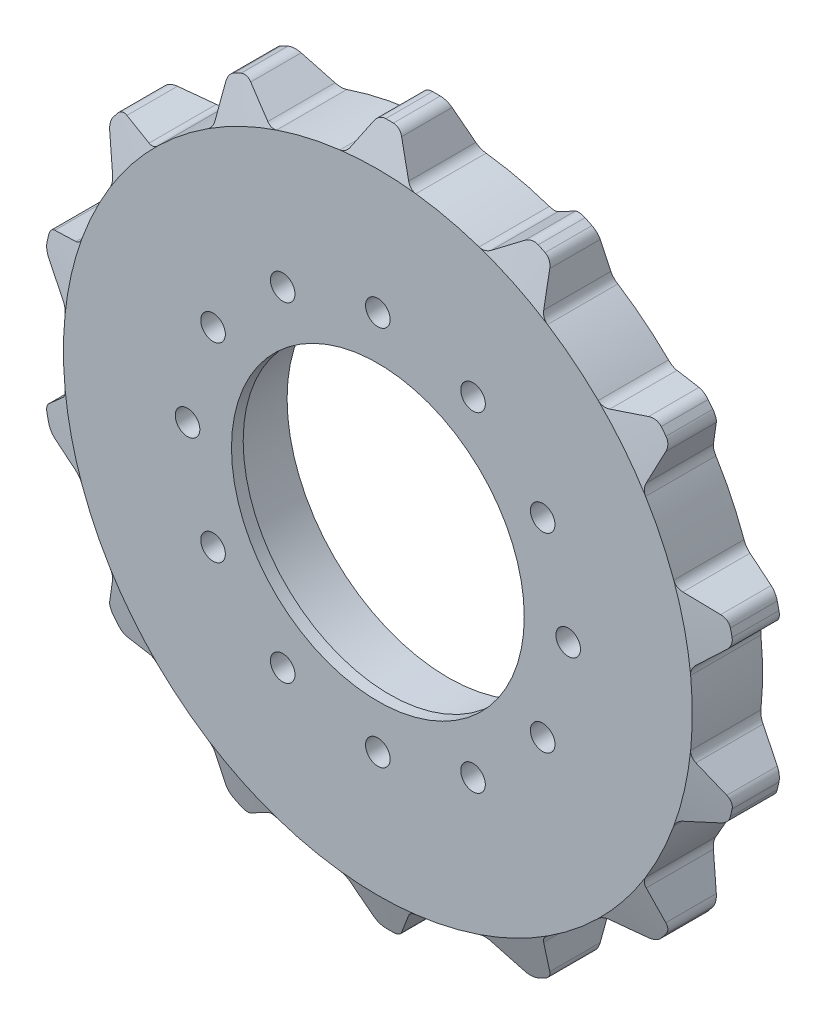
from build123d import *

# Parameters (mm, degrees)
SKETCH1_R                = 53.7
MAIN_BODY_DEPTH          = 6
TRACK_START              = -12
TRACK_TOOTH_DEPTH        = 12
FILLET5_R                = 2
CIRPATTERN4_COUNT        = 14
FILLET5_OF_CIRPATTERN4_R = 2
CUT_EXTRUDE1_DEPTH       = 85.57318465
CUT_EXTRUDE1_DEPTH_BACK  = 10
SKETCH5_R                = 27.5
M5X0_8_TAPPED_HOLE1_D    = 4.2
CIRPATTERN9_COUNT        = 12
CUT_EXTRUDE2_REACH       = 86.313
SKETCH11_R               = 25


with BuildPart() as part:
    # Sketch1 → Main Body (new, symmetric)
    with BuildSketch(Plane.XY):
        Circle(SKETCH1_R)
    extrude(amount=MAIN_BODY_DEPTH, both=True)

    # Sketch2 → Track Tooth (add)
    with BuildSketch(Plane(origin=(0, 0, -6), x_dir=(-1, 0, 0), z_dir=(0, 0, -1)).offset(TRACK_START)):
        with BuildLine():
            Line((1.801916557, -59.82286851), (5.5, -53.417600096))
            ThreePointArc((5.5, -53.417600096), (2.753622601, -53.629353554), (0, -53.7))
            Line((0, -53.7), (0, -59.85))
            ThreePointArc((0, -59.85), (0.901060403, -59.843216743), (1.801916557, -59.82286851))
        make_face()
        with BuildLine():
            Line((0, -59.85), (0, -53.7))
            ThreePointArc((0, -53.7), (-2.753622601, -53.629353554), (-5.5, -53.417600096))
            Line((-5.5, -53.417600096), (-1.801916557, -59.82286851))
            ThreePointArc((-1.801916557, -59.82286851), (-0.901060403, -59.843216743), (0, -59.85))
        make_face()
    track_tooth = extrude(amount=TRACK_TOOTH_DEPTH)

    # Fillet5
    fillet5_edges = [part.edges().sort_by_distance(p)[0] for p in [
        (5.5, -53.417600096, 0),
        (-5.5, -53.417600096, 0),
        (-1.801916557, -59.82286851, 0),
        (1.801916557, -59.82286851, 0),
    ]]
    fillet(fillet5_edges, radius=FILLET5_R)

    # CirPattern4: Track Tooth ×14 about axis
    cirpattern4_axis = Axis((0, 0, 0), (0, 0, 1))
    for i in range(1, CIRPATTERN4_COUNT):
        add(track_tooth.rotate(cirpattern4_axis, i * 360 / CIRPATTERN4_COUNT))

    # Fillet5 of CirPattern4
    fillet5_of_cirpattern4_edges = [part.edges().sort_by_distance(p)[0] for p in [
        (28.132356838, -45.741234119, 0),
        (18.221699291, -50.51395525, 0),
        (24.332699153, -54.680364409, 0),
        (27.579640594, -53.116719822, 0),
        (45.192755383, -29.005255746, 0),
        (38.334367563, -37.605402053, 0),
        (45.647925375, -38.707743527, 0),
        (47.89487857, -35.890153341, 0),
        (53.302174472, -6.524430746, 0),
        (50.854444198, -17.24863778, 0),
        (57.922020142, -15.06857932, 0),
        (58.723948452, -11.555101826, 0),
        (50.854444198, 17.24863778, 0),
        (53.302174472, 6.524430746, 0),
        (58.723948452, 11.555101826, 0),
        (57.922020142, 15.06857932, 0),
        (38.334367563, 37.605402053, 0),
        (45.192755383, 29.005255746, 0),
        (47.89487857, 35.890153341, 0),
        (45.647925375, 38.707743527, 0),
        (18.221699291, 50.51395525, 0),
        (28.132356838, 45.741234119, 0),
        (27.579640594, 53.116719822, 0),
        (24.332699153, 54.680364409, 0),
        (-5.5, 53.417600096, 0),
        (5.5, 53.417600096, 0),
        (1.801916557, 59.82286851, 0),
        (-1.801916557, 59.82286851, 0),
        (-28.132356838, 45.741234119, 0),
        (-18.221699291, 50.51395525, 0),
        (-24.332699153, 54.680364409, 0),
        (-27.579640594, 53.116719822, 0),
        (-45.192755383, 29.005255746, 0),
        (-38.334367563, 37.605402053, 0),
        (-45.647925375, 38.707743527, 0),
        (-47.89487857, 35.890153341, 0),
        (-53.302174472, 6.524430746, 0),
        (-50.854444198, 17.24863778, 0),
        (-57.922020142, 15.06857932, 0),
        (-58.723948452, 11.555101826, 0),
        (-50.854444198, -17.24863778, 0),
        (-53.302174472, -6.524430746, 0),
        (-58.723948452, -11.555101826, 0),
        (-57.922020142, -15.06857932, 0),
        (-38.334367563, -37.605402053, 0),
        (-45.192755383, -29.005255746, 0),
        (-47.89487857, -35.890153341, 0),
        (-45.647925375, -38.707743527, 0),
        (-18.221699291, -50.51395525, 0),
        (-28.132356838, -45.741234119, 0),
        (-27.579640594, -53.116719822, 0),
        (-24.332699153, -54.680364409, 0),
    ]]
    fillet(fillet5_of_cirpattern4_edges, radius=FILLET5_OF_CIRPATTERN4_R)

    # Sketch3 → Cut-Revolve3 (revolve, cut)
    with BuildSketch(Plane(origin=(0, 0, 0), x_dir=(0, 0, -1), z_dir=(1, 0, 0))):
        Polygon((-6, -59.85), (-4, -59.85), (-6, -53.7), align=None)
        Polygon((4, -59.85), (6, -59.85), (6, -53.7), align=None)
    revolve(axis=Axis((0, 0, -5.5), (0, 0, 1)), mode=Mode.SUBTRACT)

    # Sketch5 → Cut-Extrude1 (cut, two sides: drawn at the far end of the back side and taken through both)
    with BuildSketch(Plane(origin=(0, 0, -6), x_dir=(-1, 0, 0), z_dir=(0, 0, -1)).offset(-CUT_EXTRUDE1_DEPTH_BACK)):
        with Locations(Location((0, 0, 0), (0, 0, 180))):
            Circle(SKETCH5_R)
    extrude(amount=CUT_EXTRUDE1_DEPTH + CUT_EXTRUDE1_DEPTH_BACK, mode=Mode.SUBTRACT)

    # M5x0.8 Tapped Hole1 (through all)
    with Locations(Plane(origin=(0, 0, 6), x_dir=(-1, 0, 0), z_dir=(0, 0, 1))):
        with Locations((32.5, 0)):
            m5x0_8_tapped_hole1 = Hole(M5X0_8_TAPPED_HOLE1_D / 2)

    # CirPattern9: M5x0.8 Tapped Hole1 ×12 about axis
    cirpattern9_axis = Axis((0, 0, 0), (0, 0, 1))
    for i in range(1, CIRPATTERN9_COUNT):
        add(m5x0_8_tapped_hole1.rotate(cirpattern9_axis, i * 360 / CIRPATTERN9_COUNT), mode=Mode.SUBTRACT)

    # Sketch11 → Cut-Extrude2 (cut, up to next)
    with BuildSketch(Plane(origin=(0, 0, 4), x_dir=(-1, 0, 0), z_dir=(0, 0, -1)), mode=Mode.PRIVATE) as cut_extrude2_sk1:
        Circle(SKETCH11_R)
    cut_extrude2_tool1 = extrude(cut_extrude2_sk1.sketch, amount=-CUT_EXTRUDE2_REACH, mode=Mode.PRIVATE) & part.part
    add(cut_extrude2_tool1.solids().sort_by_distance((0, 0, 4))[0], mode=Mode.SUBTRACT)


solid = part.part
